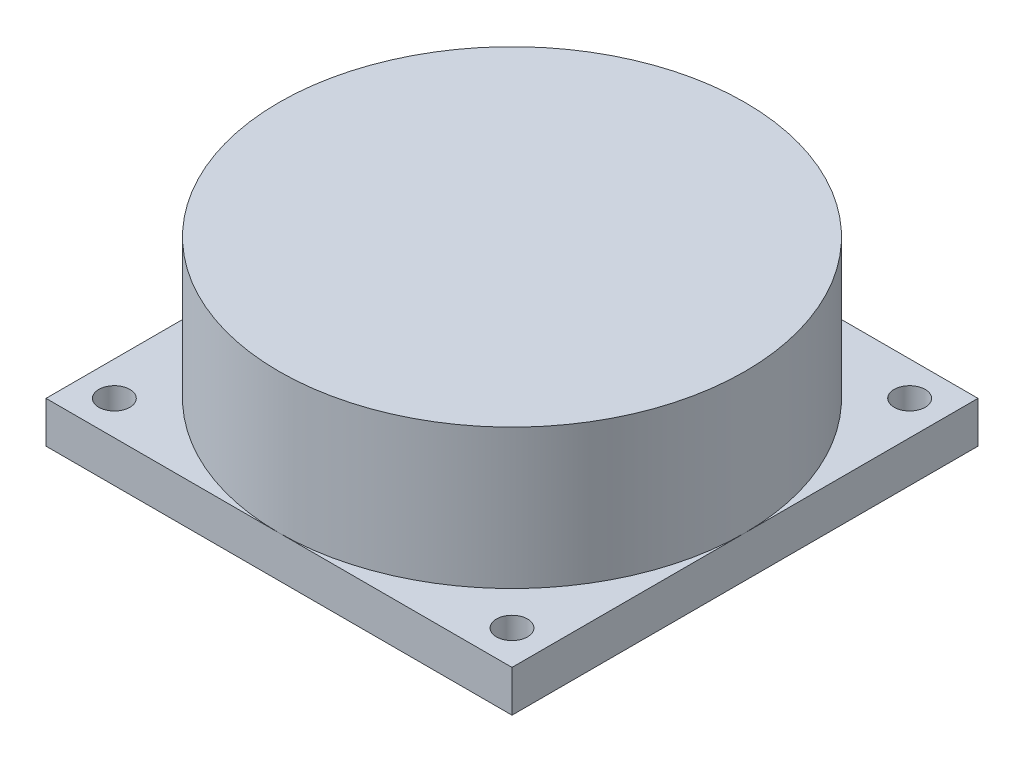
from build123d import *

# Parameters (mm, degrees)
SKETCH_1_W      = 45
SKETCH_1_H      = 45
SKETCH_1_R      = 1.5
EXTRUDE_1_DEPTH = 4
EXTRUDE_2_DEPTH = 17.5


with BuildPart() as part:
    # 草图1 → 凸台-拉伸1 (new body)
    with BuildSketch(Plane(origin=(0, 0, 0), x_dir=(1, 0, 0), z_dir=(0, 1, 0))):
        Rectangle(SKETCH_1_W, SKETCH_1_H)
        with Locations((-19.2, 19.2)):
            Circle(SKETCH_1_R, mode=Mode.SUBTRACT)
        with Locations((19.2, 19.2)):
            Circle(SKETCH_1_R, mode=Mode.SUBTRACT)
        with Locations((19.2, -19.2)):
            Circle(SKETCH_1_R, mode=Mode.SUBTRACT)
        with Locations((-19.2, -19.2)):
            Circle(SKETCH_1_R, mode=Mode.SUBTRACT)
    extrude(amount=EXTRUDE_1_DEPTH)

    # 草图1<3> → 凸台-拉伸2 (add)
    with BuildSketch(Plane(origin=(0, 0, 0), x_dir=(1, 0, 0), z_dir=(0, 1, 0))):
        with BuildLine():
            ThreePointArc((22.5, 0), (15.909902585, 15.909902568), (2.5e-08, 22.5))
            ThreePointArc((2.5e-08, 22.5), (-15.909902559, 15.909902594), (-22.5, 2.4e-08))
            ThreePointArc((-22.5, 2.4e-08), (-15.909902568, -15.909902586), (5e-08, -22.5))
            ThreePointArc((5e-08, -22.5), (15.909902594, -15.909902559), (22.5, 0))
        make_face()
    extrude(amount=EXTRUDE_2_DEPTH)


solid = part.part
